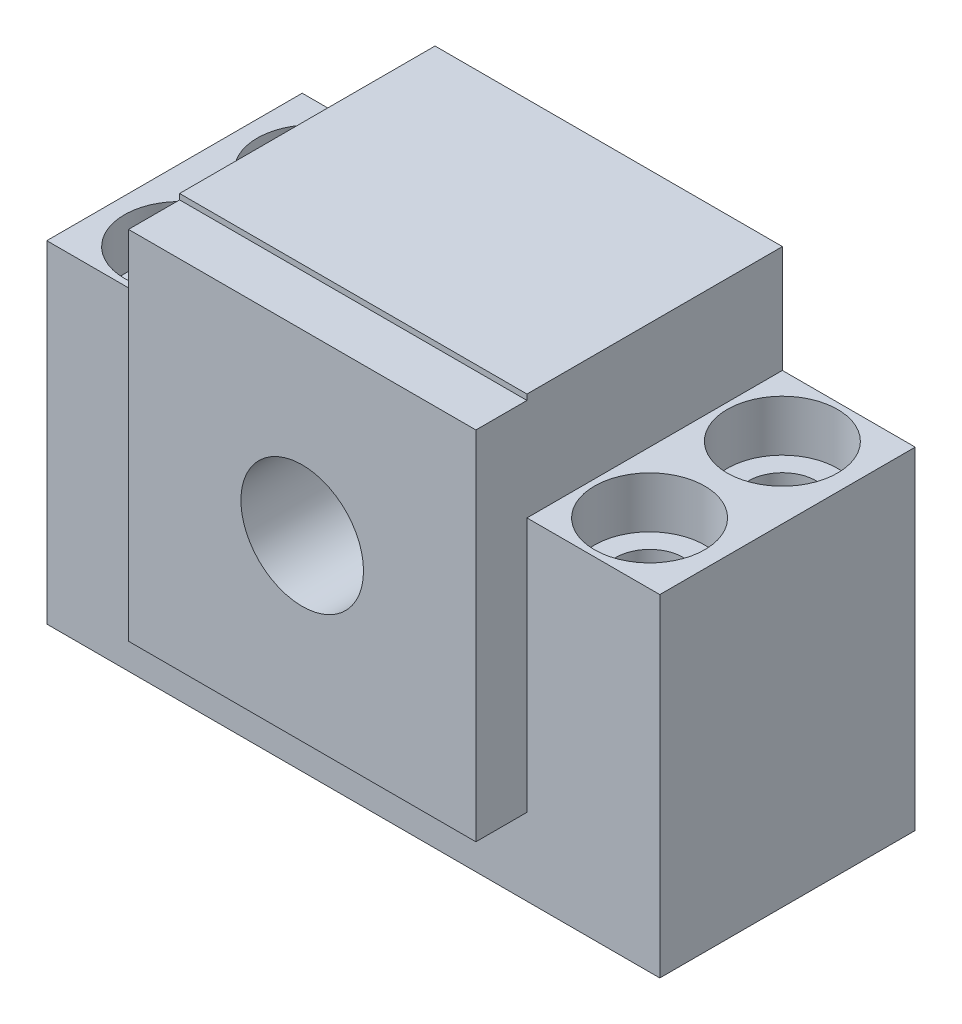
from build123d import *

# Parameters (mm, degrees)
ESQUISSE1_R             = 6
BOSS_EXTRU_1_DEPTH      = 25
ENL_V_MAT_EXTRU_1_REACH = 54.097
ESQUISSE2_R             = 3.3
ESQUISSE3_R             = 5.4
ENL_V_MAT_EXTRU_2_DEPTH = 5
ESQUISSE4_W             = 34
ESQUISSE4_H             = 34.910709465
ESQUISSE4_R             = 6
BOSS_EXTRU_2_DEPTH      = 5


with BuildPart() as part:
    # Esquisse1 → Boss.-Extru.1 (new body)
    with BuildSketch(Plane.XY):
        Polygon((-27.861974124, -13.935926773), (32.138025876, -13.935926773), (32.138025876, 18.564073227), (19.138025876, 18.564073227), (19.138025876, 29.064073227), (-14.861974124, 29.064073227), (-14.861974124, 18.564073227), (-27.861974124, 18.564073227), align=None)
        with Locations((2.138025876, 11.064073227)):
            Circle(ESQUISSE1_R, mode=Mode.SUBTRACT)
    extrude(amount=BOSS_EXTRU_1_DEPTH)

    # Esquisse2 → Enlèv. mat.-Extru.1 (cut, up to next)
    with BuildSketch(Plane(origin=(0, 18.564073227, 0), x_dir=(1, 0, 0), z_dir=(0, 1, 0)), mode=Mode.PRIVATE) as enl_v_mat_extru_1_sk1:
        with Locations(Location((25.138025876, -19, 0), (0, 0, 270))):
            Circle(ESQUISSE2_R)
    enl_v_mat_extru_1_tool1 = extrude(enl_v_mat_extru_1_sk1.sketch, amount=-ENL_V_MAT_EXTRU_1_REACH, mode=Mode.PRIVATE) & part.part
    # Esquisse2 → Enlèv. mat.-Extru.1 (cut, up to next)
    with BuildSketch(Plane(origin=(0, 18.564073227, 0), x_dir=(1, 0, 0), z_dir=(0, 1, 0)), mode=Mode.PRIVATE) as enl_v_mat_extru_1_sk2:
        with Locations(Location((25.138025876, -6, 0), (0, 0, 270))):
            Circle(ESQUISSE2_R)
    enl_v_mat_extru_1_tool2 = extrude(enl_v_mat_extru_1_sk2.sketch, amount=-ENL_V_MAT_EXTRU_1_REACH, mode=Mode.PRIVATE) & part.part
    # Esquisse2 → Enlèv. mat.-Extru.1 (cut, up to next)
    with BuildSketch(Plane(origin=(0, 18.564073227, 0), x_dir=(1, 0, 0), z_dir=(0, 1, 0)), mode=Mode.PRIVATE) as enl_v_mat_extru_1_sk3:
        with Locations(Location((-20.861974124, -19, 0), (0, 0, 270))):
            Circle(ESQUISSE2_R)
    enl_v_mat_extru_1_tool3 = extrude(enl_v_mat_extru_1_sk3.sketch, amount=-ENL_V_MAT_EXTRU_1_REACH, mode=Mode.PRIVATE) & part.part
    # Esquisse2 → Enlèv. mat.-Extru.1 (cut, up to next)
    with BuildSketch(Plane(origin=(0, 18.564073227, 0), x_dir=(1, 0, 0), z_dir=(0, 1, 0)), mode=Mode.PRIVATE) as enl_v_mat_extru_1_sk4:
        with Locations(Location((-20.861974124, -6, 0), (0, 0, 270))):
            Circle(ESQUISSE2_R)
    enl_v_mat_extru_1_tool4 = extrude(enl_v_mat_extru_1_sk4.sketch, amount=-ENL_V_MAT_EXTRU_1_REACH, mode=Mode.PRIVATE) & part.part
    add(enl_v_mat_extru_1_tool1.solids().sort_by_distance((25.138026, 18.564073, 19))[0], mode=Mode.SUBTRACT)
    add(enl_v_mat_extru_1_tool2.solids().sort_by_distance((25.138026, 18.564073, 6))[0], mode=Mode.SUBTRACT)
    add(enl_v_mat_extru_1_tool3.solids().sort_by_distance((-20.861974, 18.564073, 19))[0], mode=Mode.SUBTRACT)
    add(enl_v_mat_extru_1_tool4.solids().sort_by_distance((-20.861974, 18.564073, 6))[0], mode=Mode.SUBTRACT)

    # Esquisse3 → Enlèv. mat.-Extru.2 (cut)
    with BuildSketch(Plane(origin=(0, 18.564073227, 0), x_dir=(1, 0, 0), z_dir=(0, 1, 0))):
        with Locations(Location((25.138025876, -19, 0), (0, 0, 270))):
            Circle(ESQUISSE3_R)
        with Locations(Location((25.138025876, -6, 0), (0, 0, 270))):
            Circle(ESQUISSE3_R)
        with Locations(Location((-20.861974124, -6, 0), (0, 0, 270))):
            Circle(ESQUISSE3_R)
        with Locations(Location((-20.861974124, -19, 0), (0, 0, 270))):
            Circle(ESQUISSE3_R)
    extrude(amount=-ENL_V_MAT_EXTRU_2_DEPTH, mode=Mode.SUBTRACT)

    # Esquisse4 → Boss.-Extru.2 (add)
    with BuildSketch(Plane.XY.offset(25)):
        with Locations((2.138025876, 11.064073226)):
            Rectangle(ESQUISSE4_W, ESQUISSE4_H)
        with Locations((2.138025876, 11.064073227)):
            Circle(ESQUISSE4_R, mode=Mode.SUBTRACT)
    extrude(amount=BOSS_EXTRU_2_DEPTH)


solid = part.part
